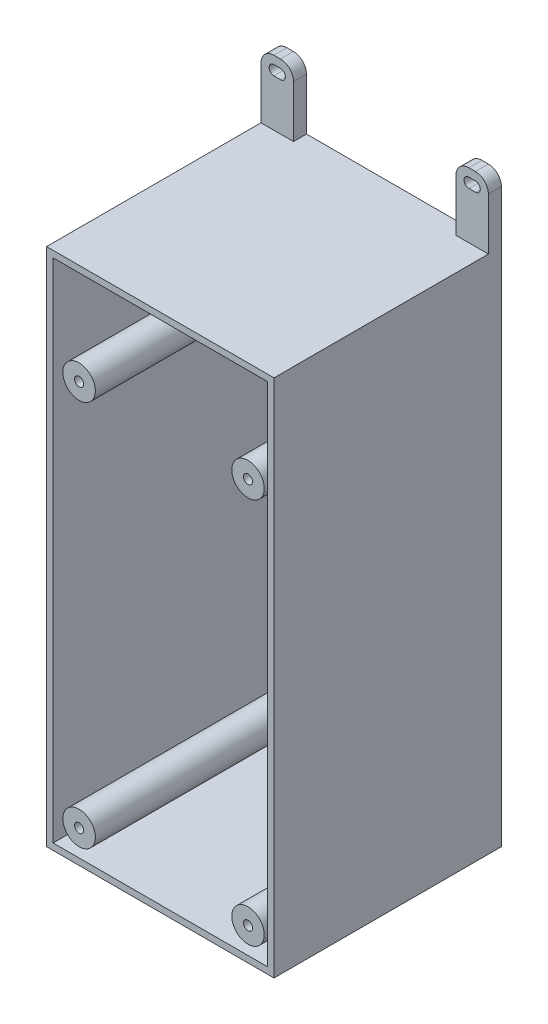
from build123d import *

# Parameters (mm, degrees)
CROQUIS1_W              = 70
CROQUIS1_H              = 160
SALIENTE_EXTRUIR1_DEPTH = 70
VACIADO1_T              = -2
CROQUIS2_W              = 13
CROQUIS2_H              = 19
CORTAR_EXTRUIR1_DEPTH   = 188.413980268
CORTAR_EXTRUIR2_DEPTH   = 188.413980268
CORTAR_EXTRUIR3_DEPTH   = 188.413980268
CROQUIS5_R              = 5
CROQUIS5_R_2            = 3
SALIENTE_EXTRUIR2_DEPTH = 67
CROQUIS6_R              = 3.05
CROQUIS6_R_2            = 1.4
SALIENTE_EXTRUIR3_DEPTH = 2
SALIENTE_EXTRUIR4_DEPTH = 4
CROQUIS8_R              = 4
CORTAR_EXTRUIR4_DEPTH   = 67


with BuildPart() as part:
    # Croquis1 → Saliente-Extruir1 (new body)
    with BuildSketch(Plane.XY):
        with Locations((35, 80)):
            Rectangle(CROQUIS1_W, CROQUIS1_H)
    extrude(amount=SALIENTE_EXTRUIR1_DEPTH)

    # Vaciado1
    vaciado1_openings = [part.faces().sort_by_distance(p)[0] for p in [
        (35, 80, 70),
    ]]
    offset(amount=VACIADO1_T, openings=vaciado1_openings, kind=Kind.INTERSECTION)

    # Croquis2 → Cortar-Extruir1 (cut, through all)
    with BuildSketch(Plane.XY.offset(2)):
        with Locations((60, 147)):
            Rectangle(CROQUIS2_W, CROQUIS2_H)
    extrude(amount=-CORTAR_EXTRUIR1_DEPTH, mode=Mode.SUBTRACT)

    # Croquis3 → Cortar-Extruir2 (cut, through all)
    with BuildSketch(Plane.XY.offset(2)):
        with BuildLine():
            Line((29.75, 14.573472877), (40.25, 14.573472877))
            ThreePointArc((40.25, 14.573472877), (44, 10.823472877), (40.25, 7.073472877))
            Line((40.25, 7.073472877), (29.75, 7.073472877))
            ThreePointArc((29.75, 7.073472877), (26, 10.823472877), (29.75, 14.573472877))
        make_face()
    extrude(amount=-CORTAR_EXTRUIR2_DEPTH, mode=Mode.SUBTRACT)

    # Croquis4 → Cortar-Extruir3 (cut, through all)
    with BuildSketch(Plane(origin=(2, 0, 0), x_dir=(0, 0, -1), z_dir=(1, 0, 0))):
        with BuildLine():
            Line((-28, 148), (-20, 148))
            ThreePointArc((-20, 148), (-17, 145), (-20, 142))
            Line((-20, 142), (-28, 142))
            ThreePointArc((-28, 142), (-31, 145), (-28, 148))
        make_face()
    extrude(amount=-CORTAR_EXTRUIR3_DEPTH, mode=Mode.SUBTRACT)

    # Croquis5 → Saliente-Extruir2 (add)
    # profile 1 of 4: a face of its own
    with BuildSketch(Plane.XY.offset(2)):
        with Locations(Location((9, 128, 0), (0, 0, 180))):
            Circle(CROQUIS5_R)
        with Locations((9, 128)):
            Circle(CROQUIS5_R_2, mode=Mode.SUBTRACT)
    # profile 2 of 4: a face of its own
    with BuildSketch(Plane.XY.offset(2)):
        with Locations(Location((9, 9, 0), (0, 0, 180))):
            Circle(CROQUIS5_R)
        with Locations((9, 9)):
            Circle(CROQUIS5_R_2, mode=Mode.SUBTRACT)
    # profile 3 of 4: a face of its own
    with BuildSketch(Plane.XY.offset(2)):
        with Locations(Location((61, 128, 0), (0, 0, 180))):
            Circle(CROQUIS5_R)
        with Locations((61, 128)):
            Circle(CROQUIS5_R_2, mode=Mode.SUBTRACT)
    # profile 4 of 4: a face of its own
    with BuildSketch(Plane.XY.offset(2)):
        with Locations(Location((61, 9, 0), (0, 0, 180))):
            Circle(CROQUIS5_R)
        with Locations((61, 9)):
            Circle(CROQUIS5_R_2, mode=Mode.SUBTRACT)
    extrude(amount=SALIENTE_EXTRUIR2_DEPTH)

    # Croquis6 → Saliente-Extruir3 (add)
    # profile 1 of 4: a face of its own
    with BuildSketch(Plane.XY.offset(69)):
        with Locations((9, 128)):
            Circle(CROQUIS6_R)
        with Locations((9, 128)):
            Circle(CROQUIS6_R_2, mode=Mode.SUBTRACT)
    # profile 2 of 4: a face of its own
    with BuildSketch(Plane.XY.offset(69)):
        with Locations((61, 128)):
            Circle(CROQUIS6_R)
        with Locations((61, 128)):
            Circle(CROQUIS6_R_2, mode=Mode.SUBTRACT)
    # profile 3 of 4: a face of its own
    with BuildSketch(Plane.XY.offset(69)):
        with Locations((61, 9)):
            Circle(CROQUIS6_R)
        with Locations((61, 9)):
            Circle(CROQUIS6_R_2, mode=Mode.SUBTRACT)
    # profile 4 of 4: a face of its own
    with BuildSketch(Plane.XY.offset(69)):
        with Locations((9, 9)):
            Circle(CROQUIS6_R)
        with Locations((9, 9)):
            Circle(CROQUIS6_R_2, mode=Mode.SUBTRACT)
    extrude(amount=-SALIENTE_EXTRUIR3_DEPTH)

    # Croquis7 → Saliente-Extruir4 (add)
    # profile 1 of 2: a face of its own
    with BuildSketch(Plane(origin=(0, 0, 0), x_dir=(-1, 0, 0), z_dir=(0, 0, -1))):
        with BuildLine():
            Line((-70, 160), (-60, 160))
            Line((-60, 160), (-60, 176))
            ThreePointArc((-60, 176), (-61.171572875, 178.828427125), (-64, 180))
            Line((-64, 180), (-66, 180))
            ThreePointArc((-66, 180), (-68.828427125, 178.828427125), (-70, 176))
            Line((-70, 176), (-70, 160))
        make_face()
        with BuildLine():
            Line((-66, 177.5), (-64, 177.5))
            ThreePointArc((-64, 177.5), (-62.5, 176), (-64, 174.5))
            Line((-64, 174.5), (-66, 174.5))
            ThreePointArc((-66, 174.5), (-67.5, 176), (-66, 177.5))
        make_face(mode=Mode.SUBTRACT)
    # profile 2 of 2: a face of its own
    with BuildSketch(Plane(origin=(0, 0, 0), x_dir=(-1, 0, 0), z_dir=(0, 0, -1))):
        with BuildLine():
            Line((0, 160), (-10, 160))
            Line((-10, 160), (-10, 176))
            ThreePointArc((-10, 176), (-8.828427125, 178.828427125), (-6, 180))
            Line((-6, 180), (-4, 180))
            ThreePointArc((-4, 180), (-1.171572875, 178.828427125), (0, 176))
            Line((0, 176), (0, 160))
        make_face()
        with BuildLine():
            Line((-6, 177.5), (-4, 177.5))
            ThreePointArc((-4, 177.5), (-2.5, 176), (-4, 174.5))
            Line((-4, 174.5), (-6, 174.5))
            ThreePointArc((-6, 174.5), (-7.5, 176), (-6, 177.5))
        make_face(mode=Mode.SUBTRACT)
    extrude(amount=-SALIENTE_EXTRUIR4_DEPTH)

    # Croquis8 → Cortar-Extruir4 (cut)
    with BuildSketch(Plane(origin=(0, 0, 0), x_dir=(-1, 0, 0), z_dir=(0, 0, -1))):
        with Locations((-61, 128)):
            Circle(CROQUIS8_R)
        with Locations((-9, 128)):
            Circle(CROQUIS8_R)
        with Locations((-61, 9)):
            Circle(CROQUIS8_R)
        with Locations((-9, 9)):
            Circle(CROQUIS8_R)
    extrude(amount=-CORTAR_EXTRUIR4_DEPTH, mode=Mode.SUBTRACT)


solid = part.part
